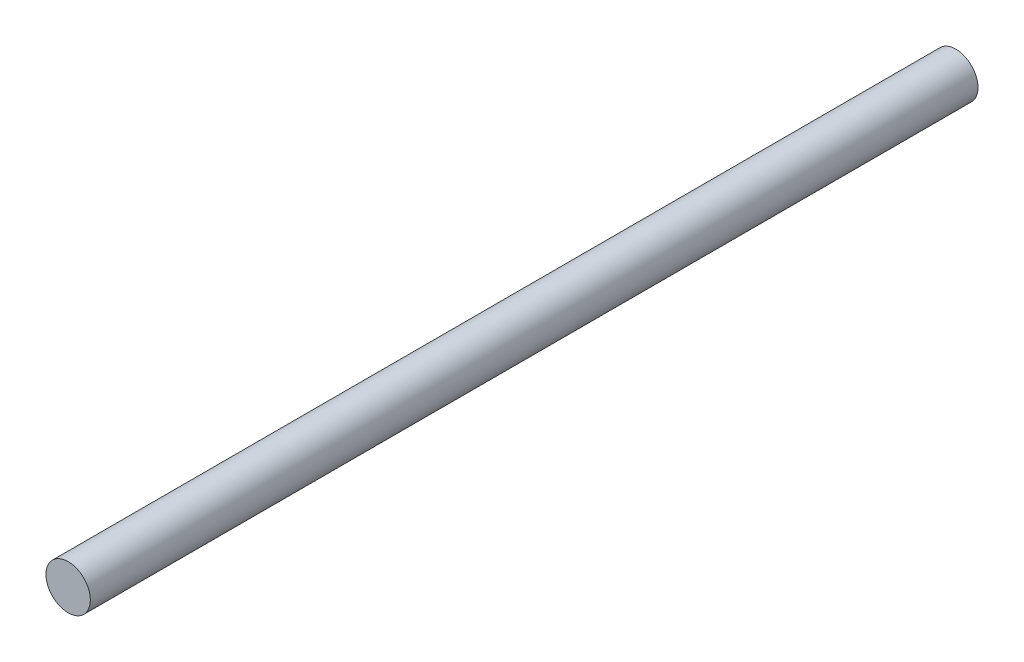
from build123d import *

# Parameters (mm, degrees)
SKETCH1_R           = 6.35
BOSS_EXTRUDE1_DEPTH = 127


with BuildPart() as part:
    # Sketch1 → Boss-Extrude1 (new, symmetric)
    with BuildSketch(Plane.XY):
        Circle(SKETCH1_R)
    extrude(amount=BOSS_EXTRUDE1_DEPTH, both=True)


solid = part.part
